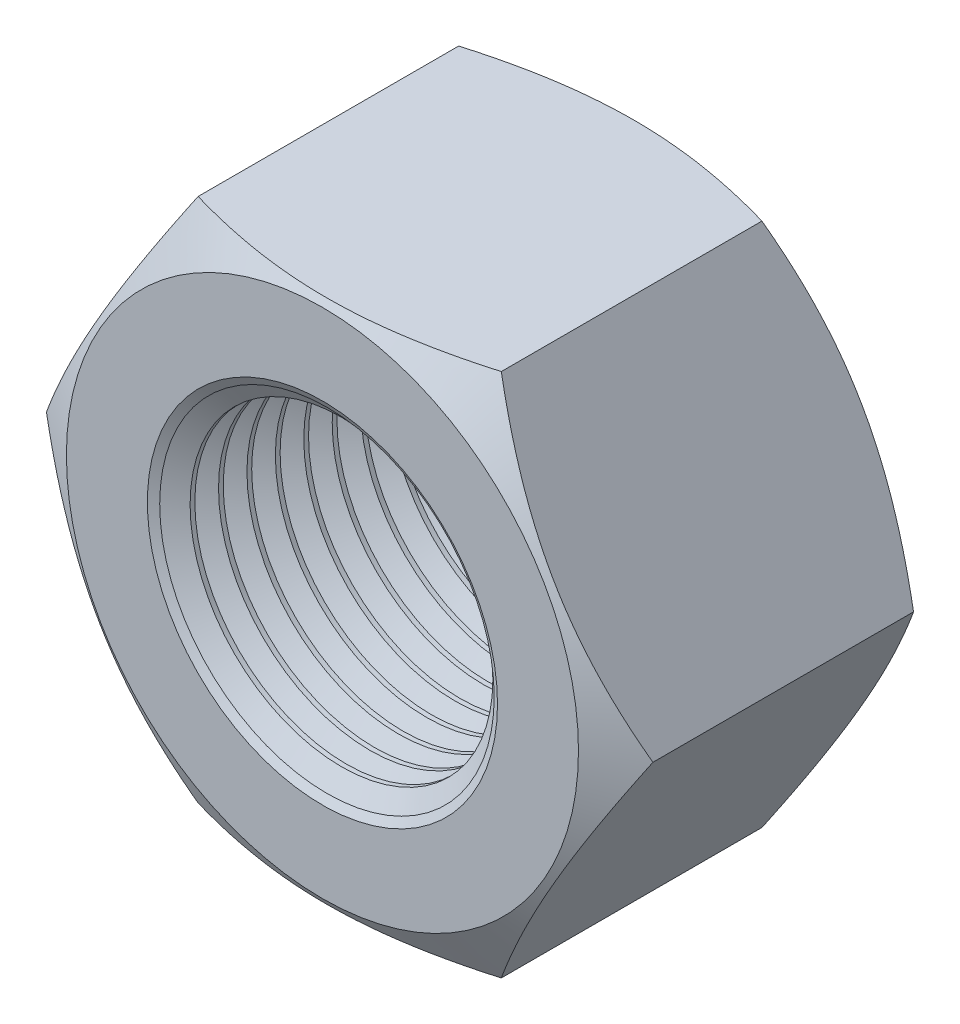
from build123d import *
from OCP.BRepFilletAPI import BRepFilletAPI_MakeChamfer

# Parameters (mm, degrees)
SKETCH1_R        = 8.647
BASENUT_DEPTH    = 18
ENDCHAMFER_SIZE  = 1.353
ENDCHAMFER_SIZE2 = 0.781154914
LPATTERN10_COUNT = 11
LPATTERN10_PITCH = 1.6236


with BuildPart() as part:
    # Sketch1 → BaseNut (new body)
    with BuildSketch(Plane.XY):
        Polygon((17.320508076, 0), (8.660254038, 15), (-8.660254038, 15), (-17.320508076, 0), (-8.660254038, -15), (8.660254038, -15), align=None)
        Circle(SKETCH1_R, mode=Mode.SUBTRACT)
    extrude(amount=-BASENUT_DEPTH)

    # Sketch2 → Double-Chamfer (revolve, cut)
    with BuildSketch(Plane(origin=(0, 0, 0), x_dir=(1, 0, 0), z_dir=(0, 1, 0))):
        Polygon((-17.320508076, 18), (-14.625, 18), (-17.320508076, 16.443747687), align=None)
        Polygon((-17.320508076, 1.556252313), (-17.320508076, 0), (-14.625, 0), align=None)
    revolve(axis=Axis((0, 0, -3.375940562), (0, 0, 1)), mode=Mode.SUBTRACT)

    # EndChamfer: one chamfer whose edges measure the first distance from different faces: ONE call of the kernel's chamfer builder (chamfer() names one face for all edges)
    endchamfer_edges_1 = [part.edges().sort_by_distance(p)[0] for p in [
        (-8.647, 0, -18),
    ]]
    endchamfer_side_1 = [part.faces().sort_by_distance(p)[0] for p in [
        (-8.647, 0, -9),
    ]]
    endchamfer_edges_2 = [part.edges().sort_by_distance(p)[0] for p in [
        (-8.647, 0, 0),
    ]]
    endchamfer_side_2 = [part.faces().sort_by_distance(p)[0] for p in [
        (14.211342533, 0, 0),
    ]]
    endchamfer = BRepFilletAPI_MakeChamfer(part.part.solid().wrapped)
    for e in endchamfer_edges_1:
        endchamfer.Add(ENDCHAMFER_SIZE, ENDCHAMFER_SIZE2, e.wrapped, endchamfer_side_1[0].wrapped)  # the first distance lies on this face
    for e in endchamfer_edges_2:
        endchamfer.Add(ENDCHAMFER_SIZE, ENDCHAMFER_SIZE2, e.wrapped, endchamfer_side_2[0].wrapped)  # the first distance lies on this face
    add(Compound.cast(endchamfer.Shape()), mode=Mode.REPLACE)

    # Sketch3 → Cut-Revolve10 (revolve, cut)
    with BuildSketch(Plane(origin=(0, 0, 0), x_dir=(1, 0, 0), z_dir=(0, 1, 0)), mode=Mode.PRIVATE) as cut_revolve10_sk:
        Polygon((-9.818732371, 16.647), (-8.647, 15.9705), (-7.294, 15.9705), (-7.294, 17.3235), (-8.647, 17.3235), align=None)
    cut_revolve10 = revolve(cut_revolve10_sk.sketch.rotate(Axis((0, 0, -7.438254559), (0, 0, -1)), 180), axis=Axis((0, 0, -7.438254559), (0, 0, -1)), mode=Mode.SUBTRACT)

    # LPattern10: Cut-Revolve10 ×11
    with Locations(*[(0, 0, i * LPATTERN10_PITCH) for i in range(1, LPATTERN10_COUNT)]):
        add(cut_revolve10, mode=Mode.SUBTRACT)


solid = part.part
